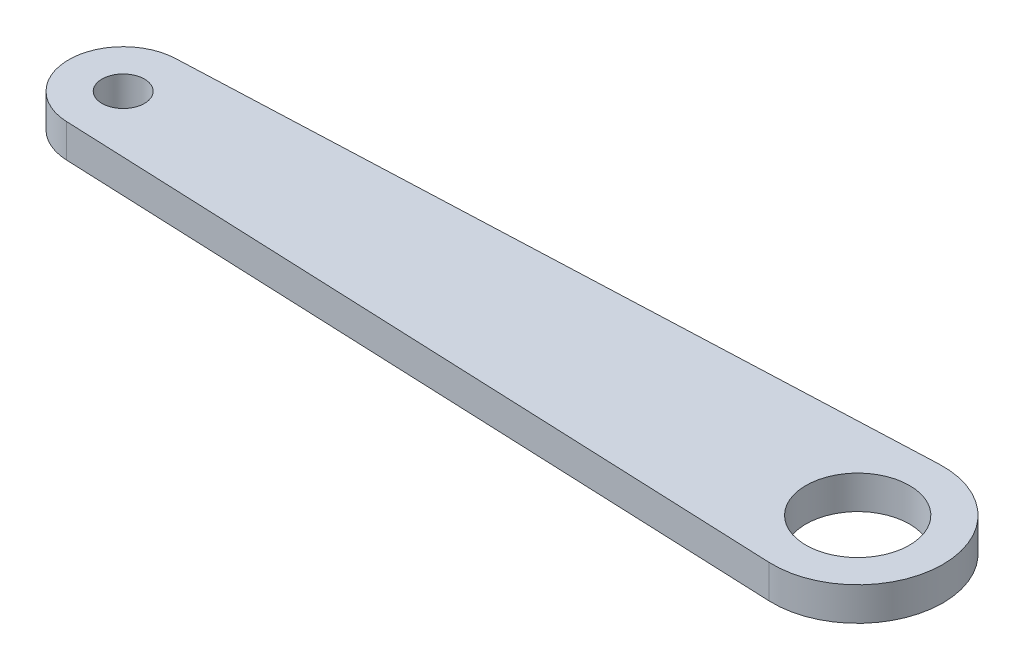
from build123d import *

# Parameters (mm, degrees)
SKETCH1_R           = 3.175
SKETCH1_R_2         = 7.75
BOSS_EXTRUDE1_DEPTH = 5


with BuildPart() as part:
    # Sketch1 → Boss-Extrude1 (new body)
    with BuildSketch(Plane(origin=(0, 5, 0), x_dir=(1, 0, 0), z_dir=(0, 1, 0))):
        with BuildLine():
            Line((-9.017537719, -3.951732009), (-118.82725931, -8.522773371))
            ThreePointArc((-118.82725931, -8.522773371), (-126.662253628, -16.690699738), (-118.82725931, -24.858626105))
            Line((-118.82725931, -24.858626105), (-9.017537719, -29.429667466))
            ThreePointArc((-9.017537719, -29.429667466), (4.262746372, -16.690699738), (-9.017537719, -3.951732009))
        make_face()
        with Locations(Location((-118.487253628, -16.690699738, 0), (0, 0, 90))):
            Circle(SKETCH1_R, mode=Mode.SUBTRACT)
        with Locations(Location((-8.487253628, -16.690699738, 0), (0, 0, 90))):
            Circle(SKETCH1_R_2, mode=Mode.SUBTRACT)
    extrude(amount=-BOSS_EXTRUDE1_DEPTH)


solid = part.part
